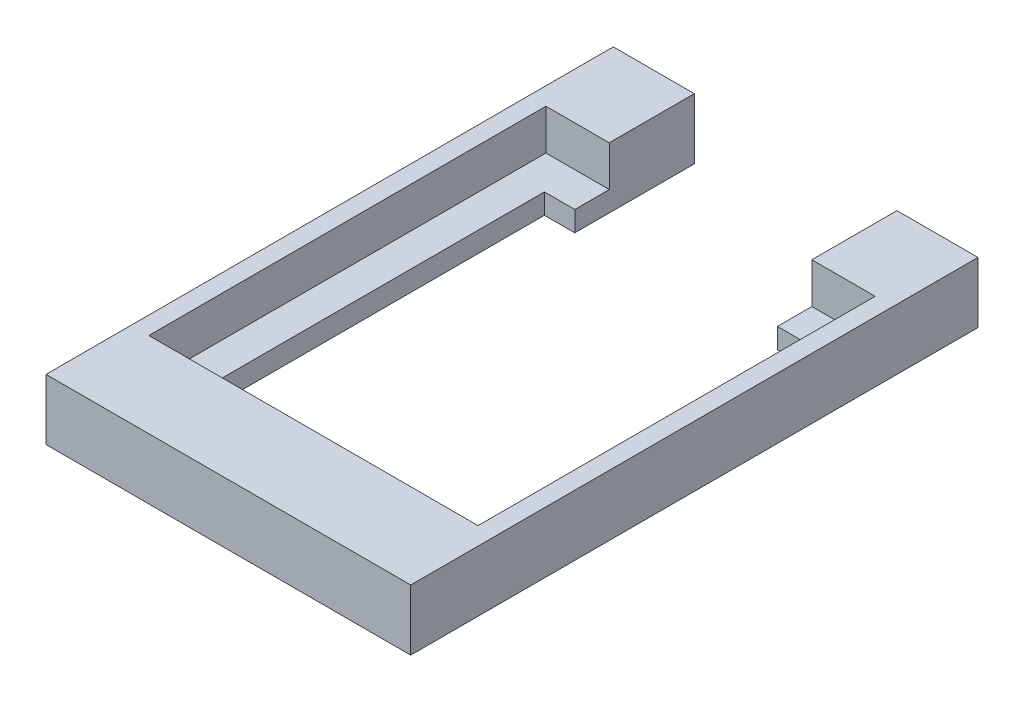
from build123d import *

# Parameters (mm, degrees)
SKETCH1_W           = 18
SKETCH1_H           = 28
SKETCH1_W_2         = 13
SKETCH1_H_2         = 16.2
BOSS_EXTRUDE1_DEPTH = 3
SKETCH1_3_W         = 13
SKETCH1_3_H         = 16.2
CUT_EXTRUDE1_DEPTH  = 17.911534525
SKETCH2_W           = 16.25
SKETCH2_H           = 19.6
CUT_EXTRUDE2_DEPTH  = 2
SKETCH4_W           = 10
SKETCH4_H           = 9
CUT_EXTRUDE3_DEPTH  = 17.911534525


with BuildPart() as part:
    # Sketch1 → Boss-Extrude1 (new body)
    # profile 1 of 2: a face of its own
    with BuildSketch(Plane(origin=(0, 0, 0), x_dir=(1, 0, 0), z_dir=(0, 1, 0))):
        Rectangle(SKETCH1_W, SKETCH1_H)
        Rectangle(SKETCH1_W_2, SKETCH1_H_2, mode=Mode.SUBTRACT)
    # profile 2 of 2: a face of its own
    with BuildSketch(Plane(origin=(0, 0, 0), x_dir=(1, 0, 0), z_dir=(0, 1, 0))):
        Rectangle(SKETCH1_W_2, SKETCH1_H_2)
    extrude(amount=BOSS_EXTRUDE1_DEPTH)

    # Sketch1<3> → Cut-Extrude1 (cut, through all)
    with BuildSketch(Plane(origin=(0, 0, 0), x_dir=(1, 0, 0), z_dir=(0, 1, 0))):
        Rectangle(SKETCH1_3_W, SKETCH1_3_H)
    extrude(amount=CUT_EXTRUDE1_DEPTH, mode=Mode.SUBTRACT)

    # Sketch2 → Cut-Extrude2 (cut)
    with BuildSketch(Plane(origin=(0, 3, 0), x_dir=(1, 0, 0), z_dir=(0, 1, 0))):
        Rectangle(SKETCH2_W, SKETCH2_H)
    extrude(amount=-CUT_EXTRUDE2_DEPTH, mode=Mode.SUBTRACT)

    # Sketch4 → Cut-Extrude3 (cut, through all)
    with BuildSketch(Plane(origin=(0, 3, 0), x_dir=(1, 0, 0), z_dir=(0, 1, 0))):
        with Locations((0, 9.8)):
            Rectangle(SKETCH4_W, SKETCH4_H)
    extrude(amount=-CUT_EXTRUDE3_DEPTH, mode=Mode.SUBTRACT)


solid = part.part
